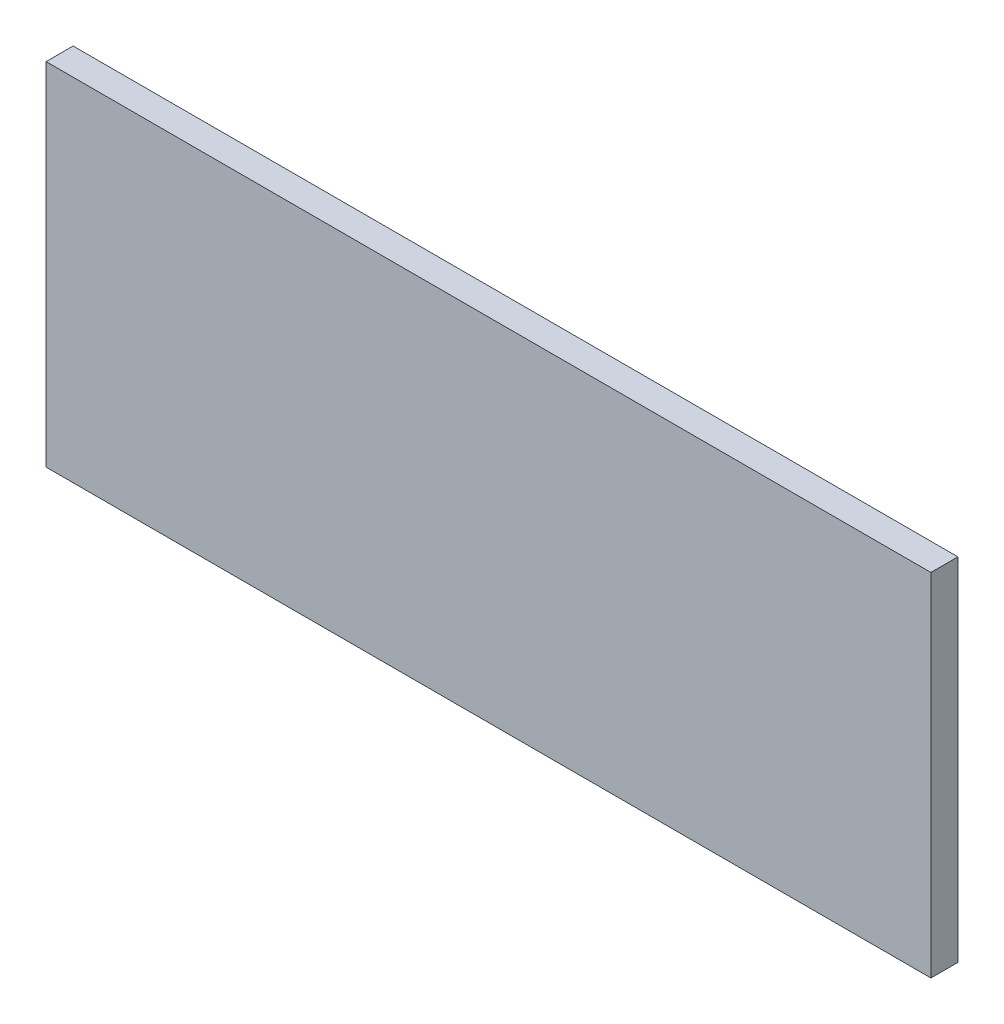
from build123d import *

# Parameters (mm, degrees)
CROQUIS1_W              = 131
CROQUIS1_H              = 52
SALIENTE_EXTRUIR1_DEPTH = 4


with BuildPart() as part:
    # Croquis1 → Saliente-Extruir1 (new body)
    with BuildSketch(Plane.XY):
        with Locations((65.5, -26)):
            Rectangle(CROQUIS1_W, CROQUIS1_H)
    extrude(amount=SALIENTE_EXTRUIR1_DEPTH)


solid = part.part
